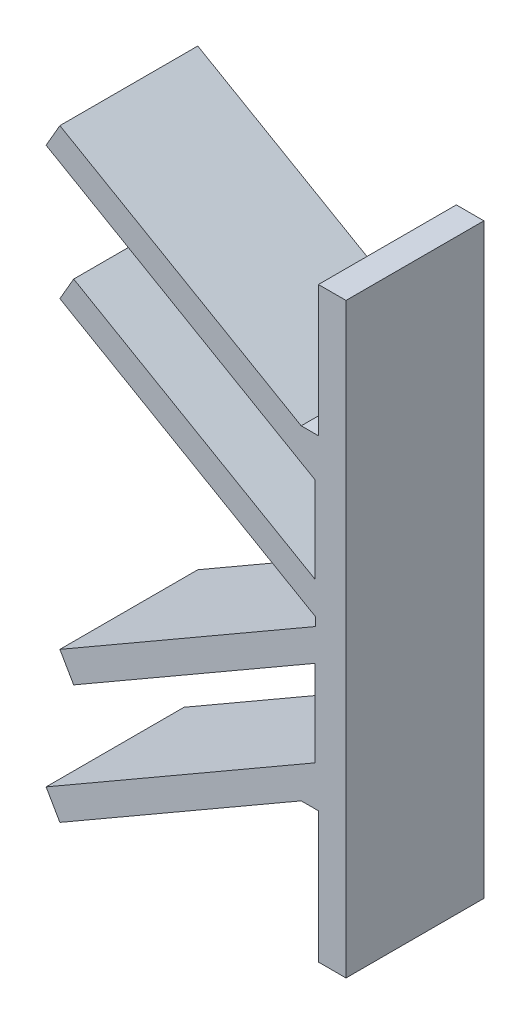
from build123d import *

# Parameters (mm, degrees)
BOSS_EXTRUDE1_DEPTH = 8


with BuildPart() as part:
    # Sketch1 → Boss-Extrude1 (new body)
    with BuildSketch(Plane(origin=(0, 0, 0), x_dir=(0, 1, 0), z_dir=(0, 0, 1))):
        Polygon((-16.6, -1.8), (-16.6, -0.2), (-9, -0.2), (-9, 0.8), (-17.082903769, 14.8), (-15.697263123, 15.6), (-6.690598923, 0), (-1.690598923, 0), (-9.773502692, 14), (-8.387862046, 14.8), (-7.935720847, 14.016868471), (0.172032948, -0.026173037), (0.672032948, -0.026173037), (8.779786743, 14.016868471), (9.231927942, 14.8), (10.617568588, 14), (2.534664819, 0), (7.534664819, 0), (16.541329018, 15.6), (17.926969664, 14.8), (9.844065896, 0.8), (9.844065896, -0.2), (17.444065896, -0.2), (17.444065896, -1.8), (0.422032948, -1.8), align=None)
    extrude(amount=BOSS_EXTRUDE1_DEPTH)


solid = part.part
